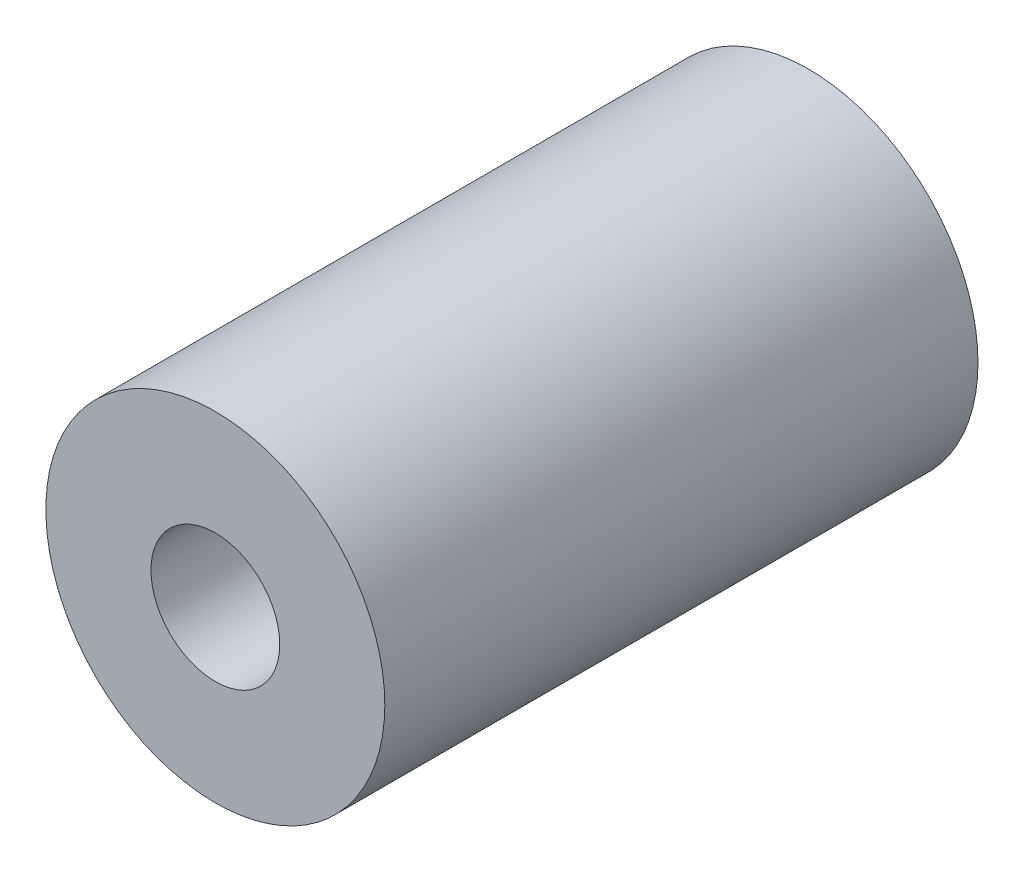
from build123d import *

# Parameters (mm, degrees)
SKETCH1_R           = 6.35
SKETCH1_R_2         = 2.413
BOSS_EXTRUDE1_DEPTH = 11.1125


with BuildPart() as part:
    # Sketch1 → Boss-Extrude1 (new, symmetric)
    with BuildSketch(Plane.XY):
        Circle(SKETCH1_R)
        Circle(SKETCH1_R_2, mode=Mode.SUBTRACT)
    extrude(amount=BOSS_EXTRUDE1_DEPTH, both=True)


solid = part.part
